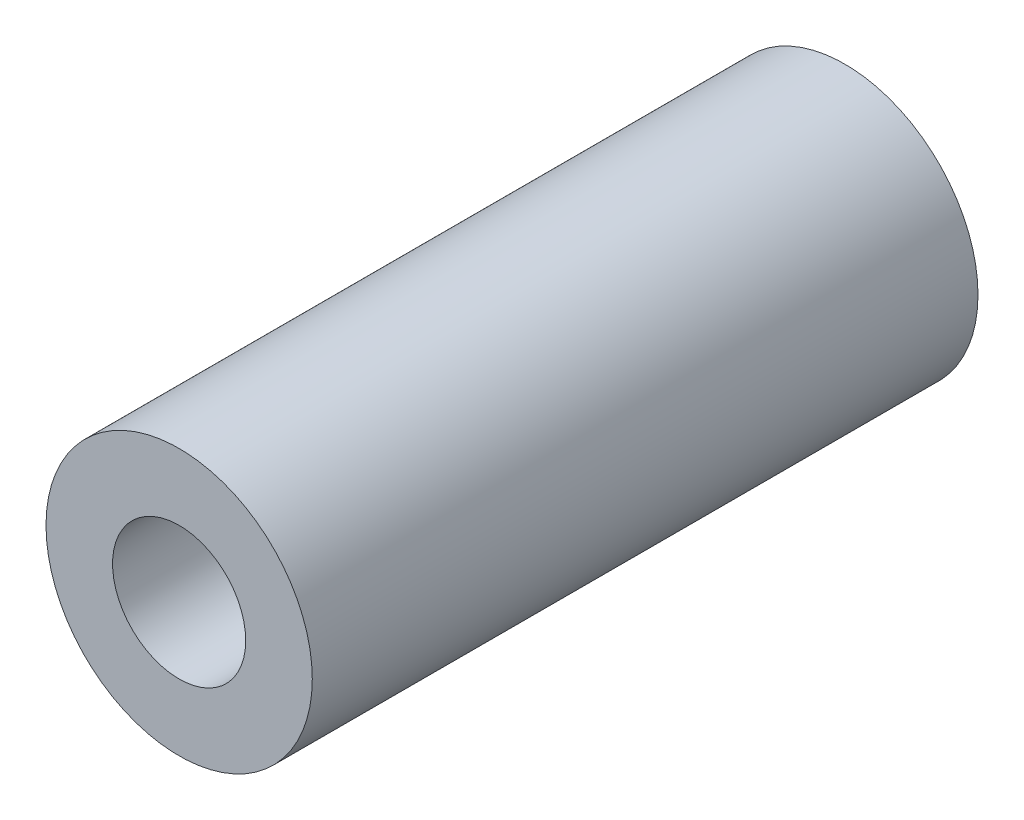
from build123d import *

# Parameters (mm, degrees)
SKETCH_1_R      = 4
SKETCH_1_R_2    = 2
EXTRUDE_1_DEPTH = 10


with BuildPart() as part:
    # 草图1 → 凸台-拉伸1 (new, symmetric)
    with BuildSketch(Plane.XY):
        Circle(SKETCH_1_R)
        Circle(SKETCH_1_R_2, mode=Mode.SUBTRACT)
    extrude(amount=EXTRUDE_1_DEPTH, both=True)


solid = part.part
